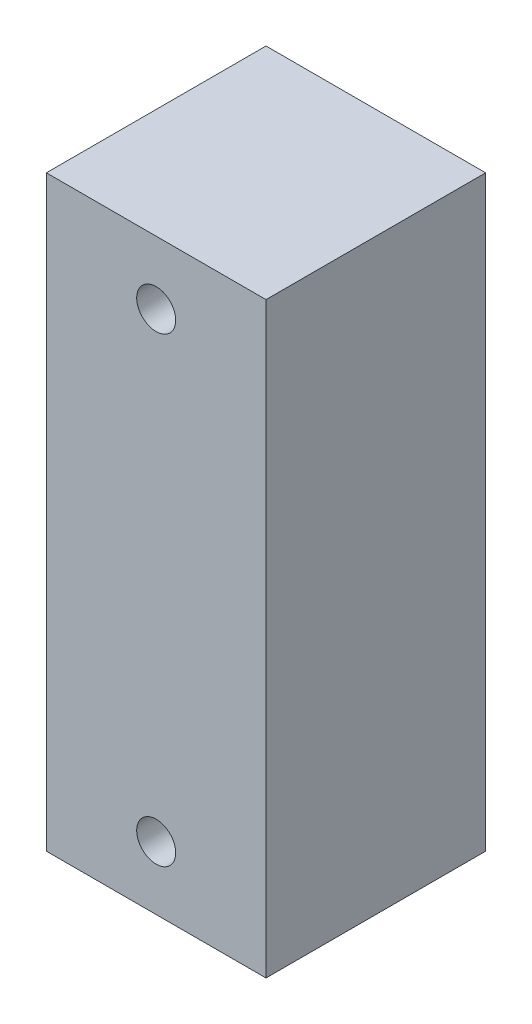
from build123d import *

# Parameters (mm, degrees)
IZIM1_W                     = 20
IZIM1_H                     = 53.5
Y_KSEKLIK_EKSTR_ZYON1_DEPTH = 20
IZIM2_R                     = 1.775
KES_EKSTR_ZYON1_DEPTH       = 59


with BuildPart() as part:
    # Çizim1 → Yükseklik-Ekstrüzyon1 (new body)
    with BuildSketch(Plane.XY):
        with Locations((-10, -26.75)):
            Rectangle(IZIM1_W, IZIM1_H)
    extrude(amount=Y_KSEKLIK_EKSTR_ZYON1_DEPTH)

    # Çizim2 → Kes-Ekstrüzyon1 (cut)
    with BuildSketch(Plane.XY.offset(20)):
        with Locations((-10, -5.75)):
            Circle(IZIM2_R)
        with Locations((-10, -47.75)):
            Circle(IZIM2_R)
    extrude(amount=-KES_EKSTR_ZYON1_DEPTH, mode=Mode.SUBTRACT)


solid = part.part
